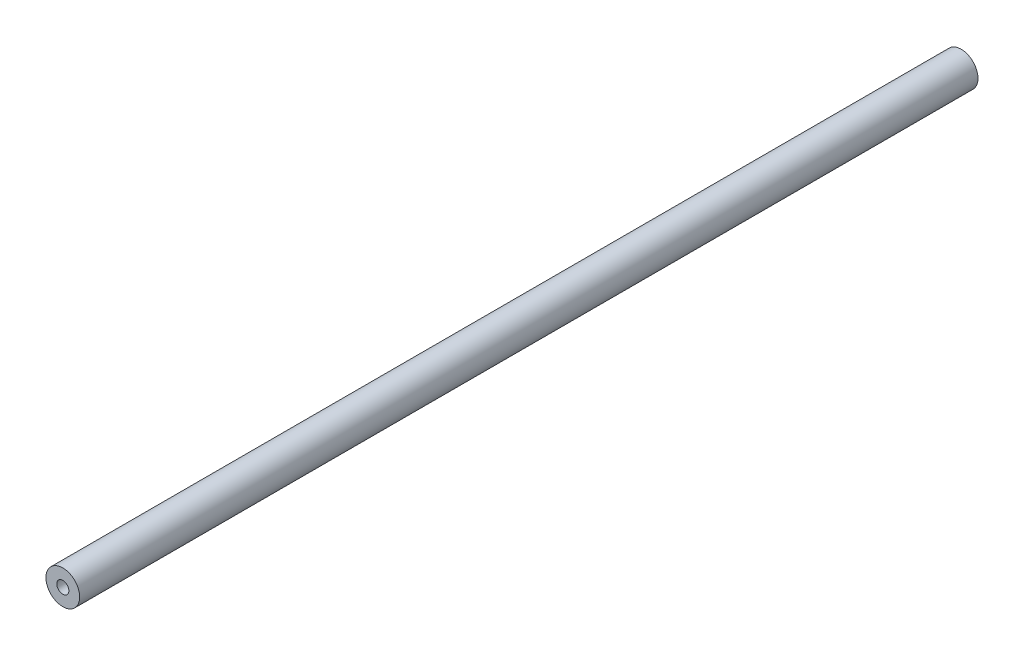
from build123d import *

# Parameters (mm, degrees)
SKETCH1_R           = 6
BOSS_EXTRUDE1_DEPTH = 320
SKETCH2_R           = 2.15
CUT_EXTRUDE1_DEPTH  = 20
CUT_EXTRUDE2_START  = -20
SKETCH3_R           = 2.15
CUT_EXTRUDE2_DEPTH  = 20


with BuildPart() as part:
    # Sketch1 → Boss-Extrude1 (new body)
    with BuildSketch(Plane.XY):
        Circle(SKETCH1_R)
    extrude(amount=BOSS_EXTRUDE1_DEPTH)

    # Sketch2 → Cut-Extrude1 (cut)
    with BuildSketch(Plane.XY.offset(320)):
        Circle(SKETCH2_R)
    extrude(amount=-CUT_EXTRUDE1_DEPTH, mode=Mode.SUBTRACT)

    # Sketch3 → Cut-Extrude2 (cut)
    with BuildSketch(Plane(origin=(0, 0, 0), x_dir=(-1, 0, 0), z_dir=(0, 0, -1)).offset(CUT_EXTRUDE2_START)):
        with Locations(Location((0, 0, 0), (0, 0, 180))):
            Circle(SKETCH3_R)
    extrude(amount=CUT_EXTRUDE2_DEPTH, mode=Mode.SUBTRACT)


solid = part.part
